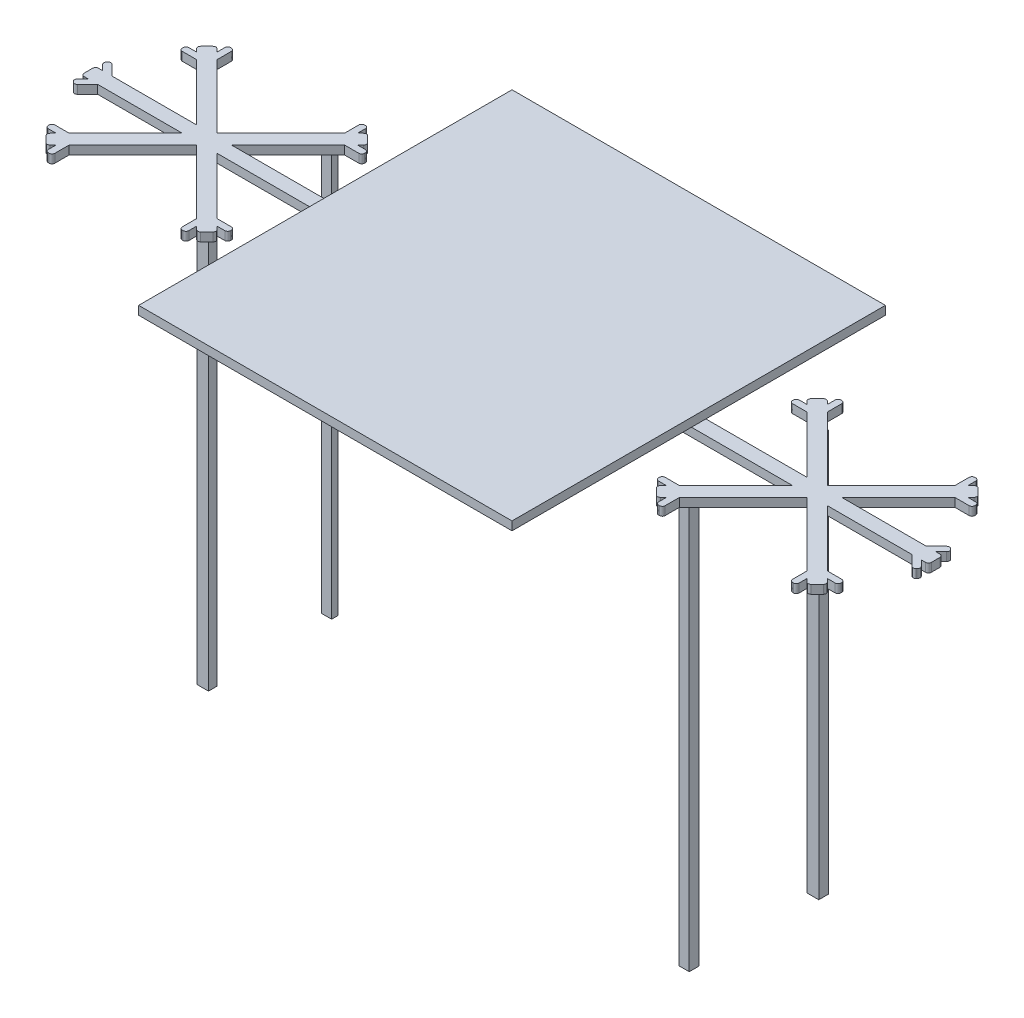
from build123d import *

# Parameters (mm, degrees)
SKETCH1_W           = 130
SKETCH1_H           = 130
BOSS_EXTRUDE1_DEPTH = 3
BOSS_EXTRUDE3_DEPTH = 3
FILLET1_R           = 1
SKETCH3_W           = 3.965686625
SKETCH3_H           = 2.959653683
SKETCH3_W_2         = 3.45962134
SKETCH3_H_2         = 2.230935605
SKETCH3_W_3         = 4.08664758
SKETCH3_H_3         = 3.34080174
SKETCH3_W_4         = 3.481915156
SKETCH3_H_4         = 3.338822753
BOSS_EXTRUDE4_DEPTH = 140


with BuildPart() as part:
    # Sketch1 → Boss-Extrude1 (new body)
    with BuildSketch(Plane(origin=(0, 0, 0), x_dir=(1, 0, 0), z_dir=(0, 1, 0))):
        Rectangle(SKETCH1_W, SKETCH1_H)
    extrude(amount=BOSS_EXTRUDE1_DEPTH)

    # Sketch2 → Boss-Extrude3 (add)
    with BuildSketch(Plane.XZ):
        Polygon((-147.50158677, -2.498414653), (-144.99841323, -2.498414653), (-147.628851167, -5.12885259), (-146.016648418, -6.74105534), (-141.77400773, -2.498414653), (-112.287119253, -2.498414653), (-131.97245322, -22.183748619), (-137.97245322, -22.183748619), (-137.97245322, -24.461573503), (-134.251863451, -24.46315885), (-136.018045056, -26.229340456), (-132.48251115, -29.764874362), (-130.714744197, -27.997107409), (-130.714744197, -31.719282525), (-128.436919314, -31.719282525), (-128.436919314, -25.719282525), (-106.25, -3.532363211), (-84.063080686, -25.719282525), (-84.063080686, -31.719282525), (-81.785255803, -31.719282525), (-81.785255803, -27.997107409), (-80.01748885, -29.764874362), (-76.483540291, -26.230925803), (-78.251307244, -24.46315885), (-74.529132128, -24.46315885), (-74.529132128, -22.185333966), (-80.529132128, -22.185333966), (-100.216051441, -2.498414653), (100.216051441, -2.498414653), (80.529132128, -22.185333966), (74.529132128, -22.185333966), (74.529132128, -24.46315885), (78.251307244, -24.46315885), (76.483540291, -26.230925803), (80.01748885, -29.764874362), (81.785255803, -27.997107409), (81.785255803, -31.719282525), (84.063080686, -31.719282525), (84.063080686, -25.719282525), (106.25, -3.532363211), (128.436919314, -25.719282525), (128.436919314, -31.719282525), (130.714744197, -31.719282525), (130.714744197, -27.997107409), (132.48251115, -29.764874362), (136.018045056, -26.229340456), (134.251863451, -24.46315885), (137.97245322, -24.461573503), (137.97245322, -22.183748619), (131.97245322, -22.183748619), (112.287119253, -2.498414653), (141.77400773, -2.498414653), (146.016648418, -6.74105534), (147.628851167, -5.12885259), (144.99841323, -2.498414653), (147.50158677, -2.498414653), (147.50158677, 2.501585347), (144.99841323, 2.501585347), (147.628851167, 5.132023285), (146.016648418, 6.744226034), (141.77400773, 2.501585347), (112.287119253, 2.501585347), (131.97245322, 22.186919314), (137.97245322, 22.186919314), (137.97245322, 24.464744197), (134.250278103, 24.464744197), (136.018045056, 26.23251115), (132.48251115, 29.768045056), (130.714744197, 28.000278103), (130.714744197, 31.72245322), (128.436919314, 31.72245322), (128.436919314, 25.72245322), (106.25, 3.535533906), (84.063080686, 25.72245322), (84.063080686, 31.72245322), (81.785255803, 31.72245322), (81.785255803, 28.000278103), (80.01748885, 29.768045056), (76.483540291, 26.234096498), (78.251307244, 24.466329545), (74.529132128, 24.466329545), (74.529132128, 22.188504661), (80.529132128, 22.188504661), (100.216051441, 2.501585347), (-100.216051441, 2.501585347), (-80.529132128, 22.188504661), (-74.529132128, 22.188504661), (-74.529132128, 24.466329545), (-78.251307244, 24.466329545), (-76.483540291, 26.234096498), (-80.01748885, 29.768045056), (-81.785255803, 28.000278103), (-81.785255803, 31.72245322), (-84.063080686, 31.72245322), (-84.063080686, 25.72245322), (-106.25, 3.535533906), (-128.436919314, 25.72245322), (-128.436919314, 31.72245322), (-130.714744197, 31.72245322), (-130.714744197, 28.000278103), (-132.48251115, 29.768045056), (-136.018045056, 26.23251115), (-134.250278103, 24.464744197), (-137.97245322, 24.464744197), (-137.97245322, 22.186919314), (-131.97245322, 22.186919314), (-112.287119253, 2.501585347), (-141.77400773, 2.501585347), (-146.016648418, 6.744226034), (-147.628851167, 5.132023285), (-144.99841323, 2.501585347), (-147.50158677, 2.501585347), align=None)
    extrude(amount=BOSS_EXTRUDE3_DEPTH)

    # Fillet1
    fillet1_edges = [part.edges().sort_by_distance(p)[0] for p in [
        (-74.529132128, -1.5, 22.188504661),
        (-74.529132128, -1.5, 24.466329545),
        (-76.483540291, -1.5, 26.234096498),
        (-80.01748885, -1.5, 29.768045056),
        (-81.785255803, -1.5, 31.72245322),
        (-84.063080686, -1.5, 31.72245322),
        (-128.436919314, -1.5, 31.72245322),
        (-130.714744197, -1.5, 31.72245322),
        (-132.48251115, -1.5, 29.768045056),
        (-136.018045056, -1.5, 26.23251115),
        (-137.97245322, -1.5, 24.464744197),
        (-137.97245322, -1.5, 22.186919314),
        (-146.016648418, -1.5, 6.744226034),
        (-147.628851167, -1.5, 5.132023285),
        (-147.50158677, -1.5, 2.501585347),
        (-147.50158677, -1.5, -2.498414653),
        (-147.628851167, -1.5, -5.12885259),
        (-146.016648418, -1.5, -6.74105534),
        (-137.97245322, -1.5, -22.183748619),
        (-137.97245322, -1.5, -24.461573503),
        (-136.018045056, -1.5, -26.229340456),
        (-132.48251115, -1.5, -29.764874362),
        (-130.714744197, -1.5, -31.719282525),
        (-128.436919314, -1.5, -31.719282525),
        (-84.063080686, -1.5, -31.719282525),
        (-81.785255803, -1.5, -31.719282525),
        (-80.01748885, -1.5, -29.764874362),
        (-76.483540291, -1.5, -26.230925803),
        (-74.529132128, -1.5, -24.46315885),
        (-74.529132128, -1.5, -22.185333966),
        (74.529132128, -1.5, -22.185333966),
        (74.529132128, -1.5, -24.46315885),
        (76.483540291, -1.5, -26.230925803),
        (80.01748885, -1.5, -29.764874362),
        (81.785255803, -1.5, -31.719282525),
        (84.063080686, -1.5, -31.719282525),
        (128.436919314, -1.5, -31.719282525),
        (130.714744197, -1.5, -31.719282525),
        (132.48251115, -1.5, -29.764874362),
        (136.018045056, -1.5, -26.229340456),
        (137.97245322, -1.5, -24.461573503),
        (137.97245322, -1.5, -22.183748619),
        (146.016648418, -1.5, -6.74105534),
        (147.628851167, -1.5, -5.12885259),
        (147.50158677, -1.5, -2.498414653),
        (147.50158677, -1.5, 2.501585347),
        (147.628851167, -1.5, 5.132023285),
        (146.016648418, -1.5, 6.744226034),
        (137.97245322, -1.5, 22.186919314),
        (137.97245322, -1.5, 24.464744197),
        (136.018045056, -1.5, 26.23251115),
        (132.48251115, -1.5, 29.768045056),
        (130.714744197, -1.5, 31.72245322),
        (128.436919314, -1.5, 31.72245322),
        (84.063080686, -1.5, 31.72245322),
        (81.785255803, -1.5, 31.72245322),
        (80.01748885, -1.5, 29.768045056),
        (76.483540291, -1.5, 26.234096498),
        (74.529132128, -1.5, 24.466329545),
        (74.529132128, -1.5, 22.188504661),
    ]]
    fillet(fillet1_edges, radius=FILLET1_R)

    # Sketch3 → Boss-Extrude4 (add)
    with BuildSketch(Plane.XZ.offset(3)):
        with Locations((-84.492316523, 21.68799042)):
            Rectangle(SKETCH3_W, SKETCH3_H)
        with Locations((-84.491523849, -21.068220718)):
            Rectangle(SKETCH3_W_2, SKETCH3_H_2)
        with Locations((84.599323341, -21.828867413)):
            Rectangle(SKETCH3_W_3, SKETCH3_H_3)
        with Locations((84.050158455, 22.420317733)):
            Rectangle(SKETCH3_W_4, SKETCH3_H_4)
    extrude(amount=BOSS_EXTRUDE4_DEPTH)


solid = part.part
